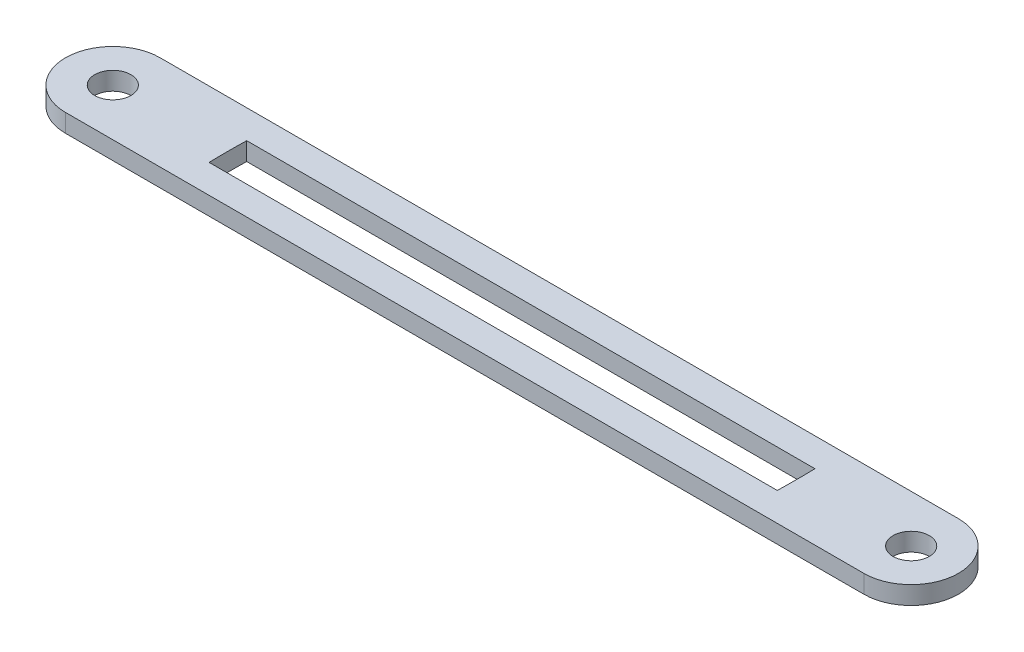
from build123d import *

# Parameters (mm, degrees)
SKETCH1_R           = 1.5875
BOSS_EXTRUDE2_DEPTH = 0.79375


with BuildPart() as part:
    # Sketch1 → Boss-Extrude2 (new, symmetric)
    with BuildSketch(Plane(origin=(0, 0, 0), x_dir=(1, 0, 0), z_dir=(0, 1, 0))):
        with BuildLine():
            Line((35, 4.15), (-35, 4.15))
            ThreePointArc((-35, 4.15), (-39.15, 0), (-35, -4.15))
            Line((-35, -4.15), (35, -4.15))
            ThreePointArc((35, -4.15), (39.15, 0), (35, 4.15))
        make_face()
        with Locations(Location((35, 0, 0), (0, 0, 270))):
            Circle(SKETCH1_R, mode=Mode.SUBTRACT)
        with Locations(Location((-35, 0, 0), (0, 0, 270))):
            Circle(SKETCH1_R, mode=Mode.SUBTRACT)
        with BuildLine():
            Line((24.907258641, -1.65), (-24.907258641, -1.65))
            ThreePointArc((-24.907258641, -1.65), (-24.929976955, 0), (-24.907258641, 1.65))
            Line((-24.907258641, 1.65), (24.907258641, 1.65))
            ThreePointArc((24.907258641, 1.65), (24.929976955, 0), (24.907258641, -1.65))
        make_face(mode=Mode.SUBTRACT)
    extrude(amount=BOSS_EXTRUDE2_DEPTH, both=True)


solid = part.part
